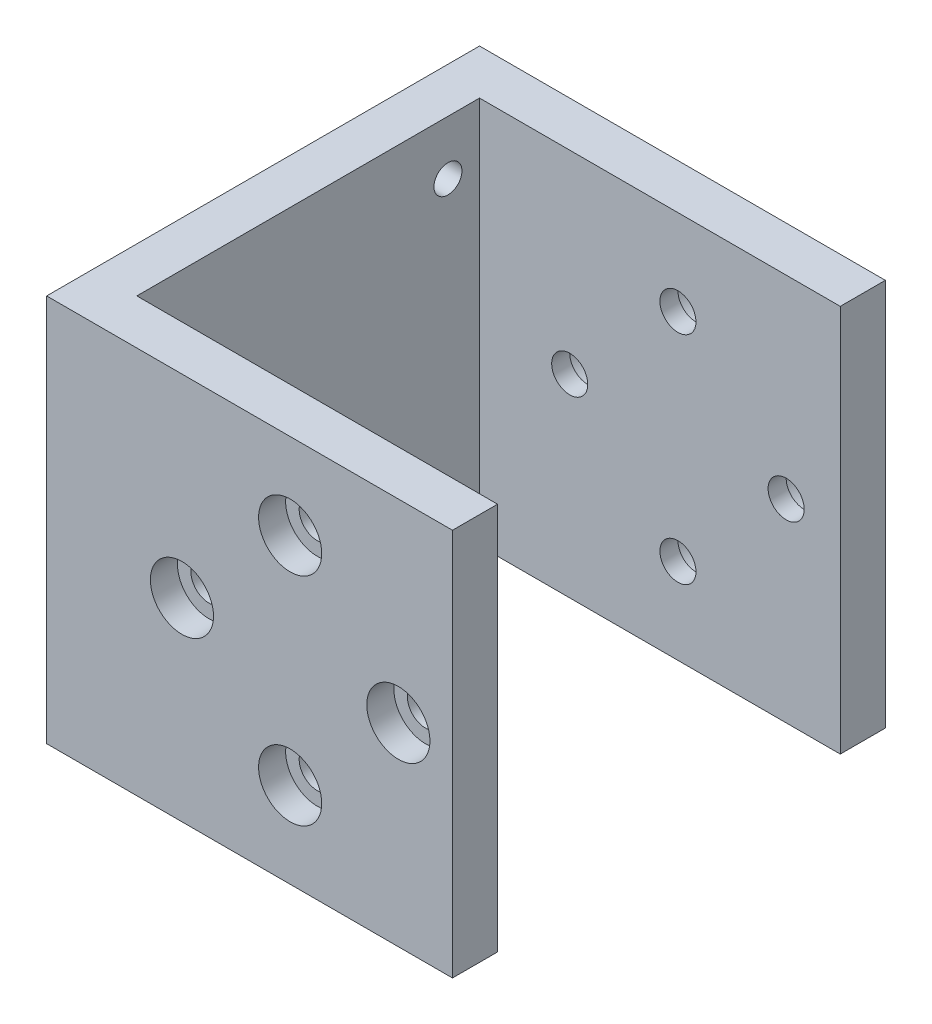
from build123d import *

# Parameters (mm, degrees)
SKETCH1_W           = 48
SKETCH1_H           = 43
BOSS_EXTRUDE1_DEPTH = 5
CUT_EXTRUDE1_REACH  = 34.608
SKETCH2_R           = 1.55
SKETCH4_W           = 5
SKETCH4_H           = 43
BOSS_EXTRUDE2_DEPTH = 40
CUT_EXTRUDE2_REACH  = 71.219
SKETCH6_R           = 2
SKETCH7_R           = 3.5
CUT_EXTRUDE3_DEPTH  = 3


with BuildPart() as part:
    # Sketch1 → Boss-Extrude1 (new body)
    with BuildSketch(Plane(origin=(0, 0, 0), x_dir=(0, 0, -1), z_dir=(1, 0, 0))):
        Rectangle(SKETCH1_W, SKETCH1_H)
    extrude(amount=BOSS_EXTRUDE1_DEPTH)

    # Sketch2 → Cut-Extrude1 (cut, up to next)
    with BuildSketch(Plane(origin=(5, 0, 0), x_dir=(0, 0, -1), z_dir=(1, 0, 0)), mode=Mode.PRIVATE) as cut_extrude1_sk1:
        with Locations((-15.5, 15.5)):
            Circle(SKETCH2_R)
    cut_extrude1_tool1 = extrude(cut_extrude1_sk1.sketch, amount=-CUT_EXTRUDE1_REACH, mode=Mode.PRIVATE) & part.part
    # Sketch2 → Cut-Extrude1 (cut, up to next)
    with BuildSketch(Plane(origin=(5, 0, 0), x_dir=(0, 0, -1), z_dir=(1, 0, 0)), mode=Mode.PRIVATE) as cut_extrude1_sk2:
        with Locations((15.5, 15.5)):
            Circle(SKETCH2_R)
    cut_extrude1_tool2 = extrude(cut_extrude1_sk2.sketch, amount=-CUT_EXTRUDE1_REACH, mode=Mode.PRIVATE) & part.part
    # Sketch2 → Cut-Extrude1 (cut, up to next)
    with BuildSketch(Plane(origin=(5, 0, 0), x_dir=(0, 0, -1), z_dir=(1, 0, 0)), mode=Mode.PRIVATE) as cut_extrude1_sk3:
        with Locations((15.5, -15.5)):
            Circle(SKETCH2_R)
    cut_extrude1_tool3 = extrude(cut_extrude1_sk3.sketch, amount=-CUT_EXTRUDE1_REACH, mode=Mode.PRIVATE) & part.part
    # Sketch2 → Cut-Extrude1 (cut, up to next)
    with BuildSketch(Plane(origin=(5, 0, 0), x_dir=(0, 0, -1), z_dir=(1, 0, 0)), mode=Mode.PRIVATE) as cut_extrude1_sk4:
        with Locations((-15.5, -15.5)):
            Circle(SKETCH2_R)
    cut_extrude1_tool4 = extrude(cut_extrude1_sk4.sketch, amount=-CUT_EXTRUDE1_REACH, mode=Mode.PRIVATE) & part.part
    add(cut_extrude1_tool1.solids().sort_by_distance((5, 15.5, 15.5))[0], mode=Mode.SUBTRACT)
    add(cut_extrude1_tool2.solids().sort_by_distance((5, 15.5, -15.5))[0], mode=Mode.SUBTRACT)
    add(cut_extrude1_tool3.solids().sort_by_distance((5, -15.5, -15.5))[0], mode=Mode.SUBTRACT)
    add(cut_extrude1_tool4.solids().sort_by_distance((5, -15.5, 15.5))[0], mode=Mode.SUBTRACT)

    # Sketch4 → Boss-Extrude2 (add)
    with BuildSketch(Plane(origin=(5, 0, 0), x_dir=(0, 0, -1), z_dir=(1, 0, 0))):
        with Locations((-21.5, 0)):
            Rectangle(SKETCH4_W, SKETCH4_H)
    boss_extrude2 = extrude(amount=BOSS_EXTRUDE2_DEPTH)

    # Sketch6 → Cut-Extrude2 (cut, up to next)
    with BuildSketch(Plane.XY.offset(24), mode=Mode.PRIVATE) as cut_extrude2_sk1:
        with Locations((27, 12)):
            Circle(SKETCH6_R)
    cut_extrude2_tool1 = extrude(cut_extrude2_sk1.sketch, amount=-CUT_EXTRUDE2_REACH, mode=Mode.PRIVATE) & part.part
    # Sketch6 → Cut-Extrude2 (cut, up to next)
    with BuildSketch(Plane.XY.offset(24), mode=Mode.PRIVATE) as cut_extrude2_sk2:
        with Locations((39, 0)):
            Circle(SKETCH6_R)
    cut_extrude2_tool2 = extrude(cut_extrude2_sk2.sketch, amount=-CUT_EXTRUDE2_REACH, mode=Mode.PRIVATE) & part.part
    # Sketch6 → Cut-Extrude2 (cut, up to next)
    with BuildSketch(Plane.XY.offset(24), mode=Mode.PRIVATE) as cut_extrude2_sk3:
        with Locations((27, -12)):
            Circle(SKETCH6_R)
    cut_extrude2_tool3 = extrude(cut_extrude2_sk3.sketch, amount=-CUT_EXTRUDE2_REACH, mode=Mode.PRIVATE) & part.part
    # Sketch6 → Cut-Extrude2 (cut, up to next)
    with BuildSketch(Plane.XY.offset(24), mode=Mode.PRIVATE) as cut_extrude2_sk4:
        with Locations((15, 0)):
            Circle(SKETCH6_R)
    cut_extrude2_tool4 = extrude(cut_extrude2_sk4.sketch, amount=-CUT_EXTRUDE2_REACH, mode=Mode.PRIVATE) & part.part
    cut_extrude2_1 = cut_extrude2_tool1.solids().sort_by_distance((27, 12, 24))[0]
    add(cut_extrude2_1, mode=Mode.SUBTRACT)
    cut_extrude2_2 = cut_extrude2_tool2.solids().sort_by_distance((39, 0, 24))[0]
    add(cut_extrude2_2, mode=Mode.SUBTRACT)
    cut_extrude2_3 = cut_extrude2_tool3.solids().sort_by_distance((27, -12, 24))[0]
    add(cut_extrude2_3, mode=Mode.SUBTRACT)
    cut_extrude2_4 = cut_extrude2_tool4.solids().sort_by_distance((15, 0, 24))[0]
    add(cut_extrude2_4, mode=Mode.SUBTRACT)
    cut_extrude2 = cut_extrude2_1 + cut_extrude2_2 + cut_extrude2_3 + cut_extrude2_4  # Cut-Extrude2 as one shape, for the pattern or mirror that repeats it

    # Sketch7 → Cut-Extrude3 (cut)
    with BuildSketch(Plane.XY.offset(24)):
        with Locations((27, 12)):
            Circle(SKETCH7_R)
        with Locations((39, 0)):
            Circle(SKETCH7_R)
        with Locations((27, -12)):
            Circle(SKETCH7_R)
        with Locations((15, 0)):
            Circle(SKETCH7_R)
    cut_extrude3 = extrude(amount=-CUT_EXTRUDE3_DEPTH, mode=Mode.SUBTRACT)

    # Mirror2: Boss-Extrude2, Cut-Extrude2, Cut-Extrude3 across plane
    add(boss_extrude2.mirror(Plane.XY))
    add(cut_extrude2.mirror(Plane.XY), mode=Mode.SUBTRACT)
    add(cut_extrude3.mirror(Plane.XY), mode=Mode.SUBTRACT)


solid = part.part
